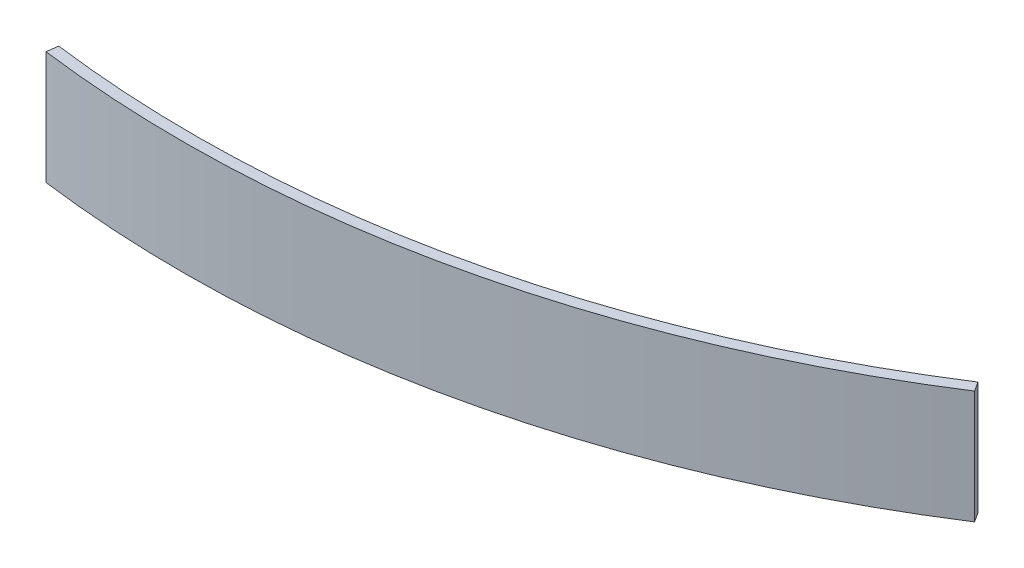
from build123d import *

# Parameters (mm, degrees)
BOSS_EXTRUDE8_DEPTH = 100


with BuildPart() as part:
    # Sketch1 → Boss-Extrude8 (new body)
    with BuildSketch(Plane(origin=(0, 0, 0), x_dir=(1, 0, 0), z_dir=(0, 1, 0))):
        with BuildLine():
            ThreePointArc((-127.334938089, -981.776865455), (217.034168342, -965.917268596), (535.086889081, -832.93578452))
            Line((535.086889081, -832.93578452), (540.491807153, -841.349277293))
            ThreePointArc((540.491807153, -841.349277293), (219.226432669, -975.674008683), (-128.621149584, -991.69380349))
            Line((-128.621149584, -991.69380349), (-127.334938089, -981.776865455))
        make_face()
    extrude(amount=BOSS_EXTRUDE8_DEPTH)


solid = part.part
